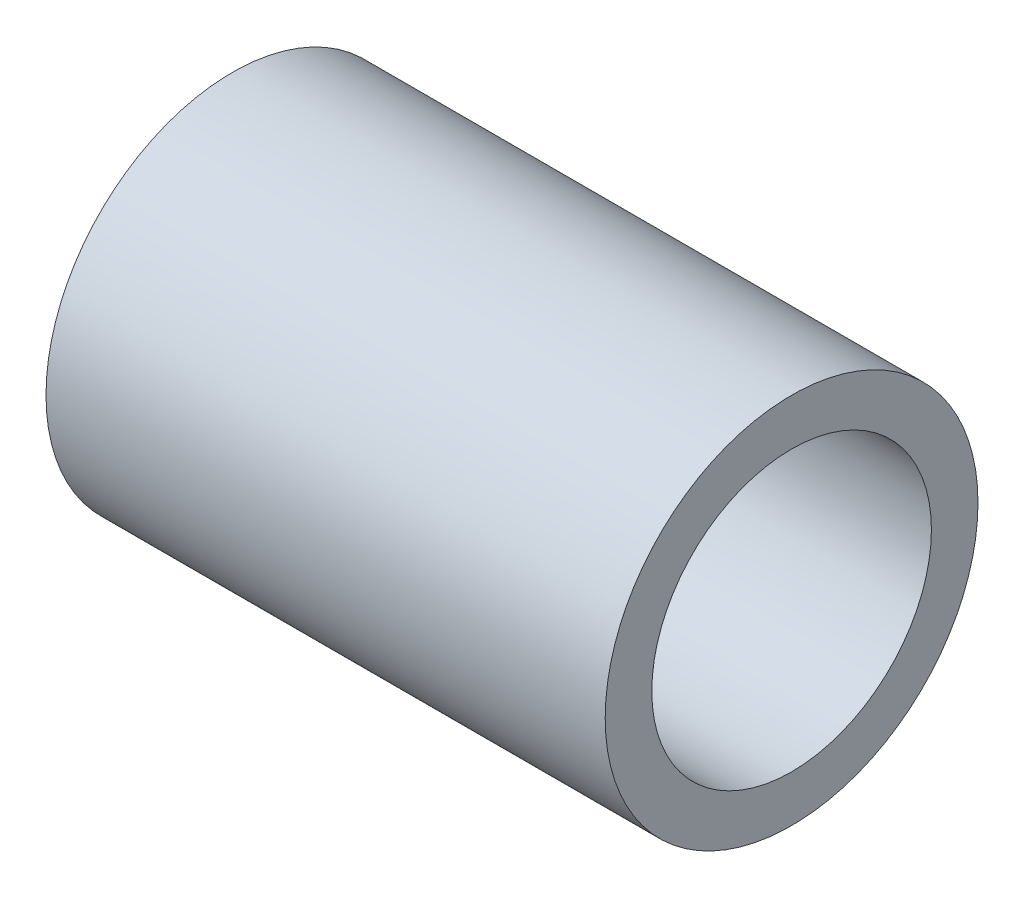
from build123d import *

# Parameters (mm, degrees)
SKETCH1_W = 12
SKETCH1_H = 4


with BuildPart() as part:
    # Sketch1 → Revolve1 (revolve)
    with BuildSketch(Plane.XY, mode=Mode.PRIVATE) as revolve1_sk:
        with Locations((6, 2)):
            Rectangle(SKETCH1_W, SKETCH1_H)
    revolve(revolve1_sk.sketch.rotate(Axis((0, 0, 0), (1, 0, 0)), 90), axis=Axis((0, 0, 0), (1, 0, 0)))

    # SurfaceCut1: cut with a surface, the side it looks to stays
    # Surface-Revolve1: a surface, the sketch's curves turned about an axis
    with BuildLine(Plane.XY, mode=Mode.PRIVATE) as surface_revolve1_1_path:
        Line((0, 3), (12, 3))
    surface_revolve1_1 = Shell.revolve(surface_revolve1_1_path.wire(), 360, Axis((0, 0, 0), (1, 0, 0)))
    split(bisect_by=surface_revolve1_1, keep=Keep.TOP)


solid = part.part
